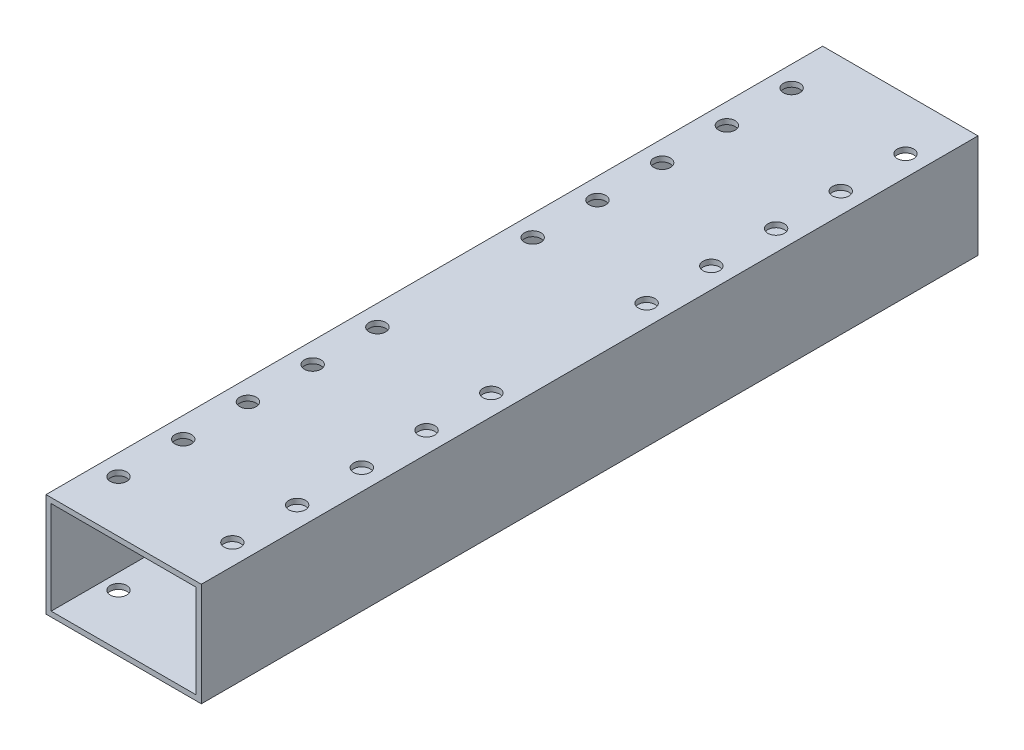
from build123d import *

# Parameters (mm, degrees)
SKETCH_1_W          = 30
SKETCH_1_H          = 20
SKETCH_1_W_2        = 28
SKETCH_1_H_2        = 18
EXTRUDE_1_DEPTH     = 75
SKETCH_2_R          = 1.6
CUT_EXTRUDE_1_DEPTH = 80.056941504


with BuildPart() as part:
    # 草图1 → 凸台-拉伸1 (new, symmetric)
    with BuildSketch(Plane.XY):
        Rectangle(SKETCH_1_W, SKETCH_1_H)
        Rectangle(SKETCH_1_W_2, SKETCH_1_H_2, mode=Mode.SUBTRACT)
    extrude(amount=EXTRUDE_1_DEPTH, both=True)

    # 草图2 → 切除-拉伸1 (cut, through all)
    with BuildSketch(Plane(origin=(0, 10, 0), x_dir=(1, 0, 0), z_dir=(0, 1, 0))):
        with Locations(Location((-11, -65, 0), (0, 0, 270))):
            Circle(SKETCH_2_R)
        with Locations(Location((-11, -52.5, 0), (0, 0, 270))):
            Circle(SKETCH_2_R)
        with Locations(Location((-11, -40, 0), (0, 0, 270))):
            Circle(SKETCH_2_R)
        with Locations(Location((-11, -27.5, 0), (0, 0, 270))):
            Circle(SKETCH_2_R)
        with Locations(Location((11, -27.5, 0), (0, 0, 180))):
            Circle(SKETCH_2_R)
        with Locations(Location((11, -40, 0), (0, 0, 180))):
            Circle(SKETCH_2_R)
        with Locations(Location((11, -52.5, 0), (0, 0, 180))):
            Circle(SKETCH_2_R)
        with Locations(Location((11, -65, 0), (0, 0, 180))):
            Circle(SKETCH_2_R)
        with Locations(Location((11, 27.5, 0), (0, 0, 270))):
            Circle(SKETCH_2_R)
        with Locations(Location((-11, 27.5, 0), (0, 0, 180))):
            Circle(SKETCH_2_R)
        with Locations(Location((11, 40, 0), (0, 0, 270))):
            Circle(SKETCH_2_R)
        with Locations(Location((-11, 40, 0), (0, 0, 180))):
            Circle(SKETCH_2_R)
        with Locations(Location((11, 52.5, 0), (0, 0, 270))):
            Circle(SKETCH_2_R)
        with Locations(Location((-11, 52.5, 0), (0, 0, 180))):
            Circle(SKETCH_2_R)
        with Locations(Location((11, 65, 0), (0, 0, 270))):
            Circle(SKETCH_2_R)
        with Locations(Location((-11, 65, 0), (0, 0, 180))):
            Circle(SKETCH_2_R)
        with Locations(Location((-11, -15, 0), (0, 0, 270))):
            Circle(SKETCH_2_R)
        with Locations(Location((11, -15, 0), (0, 0, 180))):
            Circle(SKETCH_2_R)
        with Locations(Location((11, 15, 0), (0, 0, 270))):
            Circle(SKETCH_2_R)
        with Locations(Location((-11, 15, 0), (0, 0, 180))):
            Circle(SKETCH_2_R)
    extrude(amount=-CUT_EXTRUDE_1_DEPTH, mode=Mode.SUBTRACT)


solid = part.part
